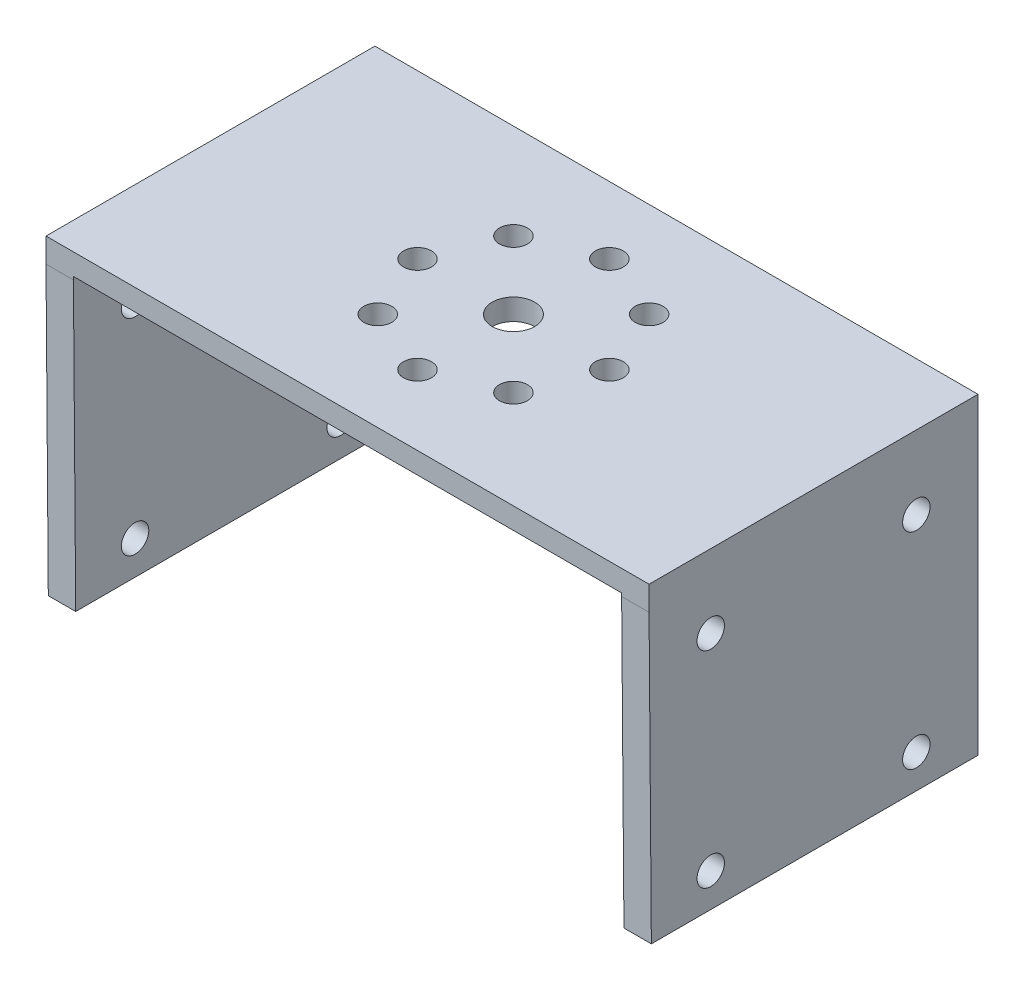
from build123d import *

# Parameters (mm, degrees)
SKETCH_1_W               = 20
SKETCH_1_H               = 40
EXTRUDE_1_DEPTH          = 40
SKETCH_2_R               = 1
CUT_EXTRUDE_3_DEPTH      = 40
EXTRUDE_2_DEPTH          = 5
EXTRUDE_2_DEPTH_BACK     = 45
CHAMFER_1_SIZE           = 2
FILLET_1_R               = 1
SKETCH_5_R               = 3
EXTRUDE_3_DEPTH          = 50
EXTRUDE_4_DEPTH          = 1.5
EXTRUDE_4_DEPTH_BACK     = 53
SKETCH_7_R               = 3
SKETCH_12_W              = 1.5
SKETCH_12_H              = 6.856105301
CUT_EXTRUDE_6_DEPTH      = 25.5
EXTRUDE_START            = 6.5
SKETCH_9_R               = 3
EXTRUDE_7_DEPTH          = 6.5
EXTRUDE_9_DEPTH          = 2
EXTRUDE_9_DEPTH_BACK     = 42
SKETCH_13_R              = 1
CUT_EXTRUDE_8_DEPTH      = 42
CUT_EXTRUDE_8_DEPTH_BACK = 42
SKETCH_15_R              = 1.548049479
SKETCH_15_R_2            = 1.02
CUT_EXTRUDE_9_DEPTH      = 42


with BuildPart() as part:
    # ｽｹｯﾁ1 → ﾎﾞｽ - 押し出し1 (new body)
    with BuildSketch(Plane(origin=(0, 0, 0), x_dir=(0, 0, -1), z_dir=(1, 0, 0))):
        with Locations((-16.51810585, 9.247910864)):
            Rectangle(SKETCH_1_W, SKETCH_1_H)
    extrude(amount=EXTRUDE_1_DEPTH)

    # ｽｹｯﾁ2 → ｶｯﾄ - 押し出し3 (cut)
    with BuildSketch(Plane.ZY):
        with Locations((9.01810585, 26.201539891)):
            Circle(SKETCH_2_R)
        with Locations((9.01810585, 11.201539891)):
            Circle(SKETCH_2_R)
        with Locations((24.01810585, 11.201539891)):
            Circle(SKETCH_2_R)
        with Locations((24.01810585, 26.201539891)):
            Circle(SKETCH_2_R)
    extrude(amount=-CUT_EXTRUDE_3_DEPTH, mode=Mode.SUBTRACT)

    # ｽｹｯﾁ4 → ﾎﾞｽ - 押し出し2 (add, two sides: drawn at the far end of the back side and taken through both)
    with BuildSketch(Plane.ZY.offset(-EXTRUDE_2_DEPTH_BACK)):
        with BuildLine():
            ThreePointArc((16.51810585, -2.252089136), (17.578766021, -1.812749308), (18.01810585, -0.752089136))
            ThreePointArc((18.01810585, -0.752089136), (15.457445678, 0.308571035), (16.51810585, -2.252089136))
        make_face()
    extrude(amount=EXTRUDE_2_DEPTH + EXTRUDE_2_DEPTH_BACK)

    # 面取り1
    chamfer_1_edges = [part.edges().sort_by_distance(p)[0] for p in [
        (20, 29.247910864, 26.51810585),
        (20, 29.247910864, 6.51810585),
        (20, -10.752089136, 6.51810585),
        (20, -10.752089136, 26.51810585),
    ]]
    chamfer(chamfer_1_edges, length=CHAMFER_1_SIZE)

    # ﾌｨﾚｯﾄ1
    fillet_1_edges = [part.edges().sort_by_distance(p)[0] for p in [
        (0, 28.247910864, 25.51810585),
        (0, 29.247910864, 16.51810585),
        (0, 28.247910864, 7.51810585),
        (0, 9.247910864, 6.51810585),
        (0, -9.752089136, 7.51810585),
        (0, -10.752089136, 16.51810585),
        (0, -9.752089136, 25.51810585),
        (0, 9.247910864, 26.51810585),
        (40, -9.752089136, 7.51810585),
        (40, -10.752089136, 16.51810585),
        (40, -9.752089136, 25.51810585),
        (40, 9.247910864, 26.51810585),
        (40, 28.247910864, 25.51810585),
        (40, 29.247910864, 16.51810585),
        (40, 28.247910864, 7.51810585),
        (40, 9.247910864, 6.51810585),
    ]]
    fillet(fillet_1_edges, radius=FILLET_1_R)

    # ｽｹｯﾁ5 → ﾎﾞｽ - 押し出し3 (add)
    with BuildSketch(Plane.ZY.offset(5)):
        with Locations((16.51810585, -0.752089136)):
            Circle(SKETCH_5_R)
    extrude(amount=-EXTRUDE_3_DEPTH)

    # ｽｹｯﾁ7 → ﾎﾞｽ - 押し出し4 (add, two sides: drawn at the far end of the back side and taken through both)
    with BuildSketch(Plane.ZY.offset(5).offset(-EXTRUDE_4_DEPTH_BACK)):
        with Locations((16.51810585, -0.752089136)):
            Circle(SKETCH_7_R)
    extrude(amount=EXTRUDE_4_DEPTH + EXTRUDE_4_DEPTH_BACK)

    # ｽｹｯﾁ12 → ｶｯﾄ - 押し出し6 (cut)
    with BuildSketch(Plane.XY):
        with Locations((47.25, -0.324036486)):
            Rectangle(SKETCH_12_W, SKETCH_12_H)
    extrude(amount=CUT_EXTRUDE_6_DEPTH, mode=Mode.SUBTRACT)

    # ｽｹｯﾁ9 → ﾎﾞｽ - 押し出し7 (add)
    with BuildSketch(Plane.ZY.offset(EXTRUDE_START)):
        with Locations((16.51810585, -0.752089136)):
            Circle(SKETCH_9_R)
    extrude(amount=-EXTRUDE_7_DEPTH)

    # ｽｹｯﾁ13 → ﾎﾞｽ - 押し出し9 (add, two sides: drawn at the far end of the back side and taken through both)
    with BuildSketch(Plane.ZY.offset(-EXTRUDE_9_DEPTH_BACK)):
        Polygon((28.350606437, 8.743176741), (28.51810585, 29.776884849), (28.51810585, 31.554442305), (4.51810585, 31.554442305), (4.51810585, 8.743176741), align=None)
        with Locations((24.01810585, 26.201539891)):
            Circle(SKETCH_13_R, mode=Mode.SUBTRACT)
        with Locations((9.01810585, 11.201539891)):
            Circle(SKETCH_13_R, mode=Mode.SUBTRACT)
        with Locations((24.01810585, 11.201539891)):
            Circle(SKETCH_13_R, mode=Mode.SUBTRACT)
        with Locations((9.01810585, 26.201539891)):
            Circle(SKETCH_13_R, mode=Mode.SUBTRACT)
    extrude(amount=EXTRUDE_9_DEPTH + EXTRUDE_9_DEPTH_BACK)

    # ｽｹｯﾁ14 → ｶｯﾄ - 押し出し8 (cut, two sides: drawn at the far end of the back side and taken through both)
    with BuildSketch(Plane(origin=(0, 0, 6.51810585), x_dir=(-1, 0, 0), z_dir=(0, 0, -1)).offset(-CUT_EXTRUDE_8_DEPTH_BACK)):
        Polygon((-40, 2.426770895), (-40, 30.001767149), (0, 30.001767149), (0, 7.074046983), (16.825190811, 7.428599357), (20.42980661, -19.990117542), (-71.103797865, -17.153698552), (-61.176331402, 0), (-52.017061748, 5.892205738), align=None)
    extrude(amount=CUT_EXTRUDE_8_DEPTH + CUT_EXTRUDE_8_DEPTH_BACK, mode=Mode.SUBTRACT)

    # ｽｹｯﾁ15 → ｶｯﾄ - 押し出し9 (cut)
    with BuildSketch(Plane.XZ.offset(-30.001767149)):
        with Locations((20, 16.413361069)):
            Circle(SKETCH_15_R)
        with Locations((20, 23.413361069)):
            Circle(SKETCH_15_R_2)
        with Locations((15.050252532, 21.363108537)):
            Circle(SKETCH_15_R_2)
        with Locations((13, 16.413361069)):
            Circle(SKETCH_15_R_2)
        with Locations((15.050252532, 11.4636136)):
            Circle(SKETCH_15_R_2)
        with Locations((20, 9.413361069)):
            Circle(SKETCH_15_R_2)
        with Locations((24.949747468, 11.4636136)):
            Circle(SKETCH_15_R_2)
        with Locations((27, 16.413361069)):
            Circle(SKETCH_15_R_2)
        with Locations((24.949747468, 21.363108537)):
            Circle(SKETCH_15_R_2)
    extrude(amount=-CUT_EXTRUDE_9_DEPTH, mode=Mode.SUBTRACT)


solid = part.part
